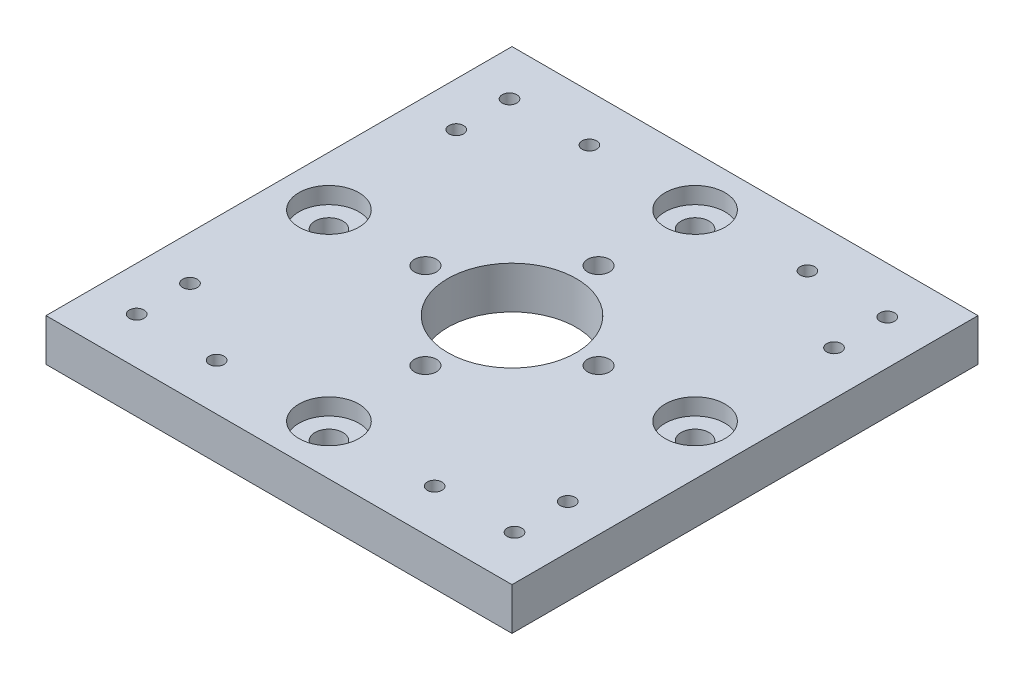
from build123d import *

# Parameters (mm, degrees)
SKETCH1_W           = 70
SKETCH1_H           = 70
SKETCH1_R           = 1.65
BOSS_EXTRUDE1_DEPTH = 6.35
CUT_EXTRUDE1_REACH  = 51.903
SKETCH2_R           = 1.1
CUT_EXTRUDE2_REACH  = 51.903
SKETCH3_R           = 9.65
CUT_EXTRUDE3_REACH  = 51.903
SKETCH4_R           = 2.1
SKETCH5_R           = 4.5
CUT_EXTRUDE4_DEPTH  = 2.5


with BuildPart() as part:
    # Sketch1 → Boss-Extrude1 (new body)
    with BuildSketch(Plane(origin=(0, 0, 0), x_dir=(1, 0, 0), z_dir=(0, 1, 0))):
        Rectangle(SKETCH1_W, SKETCH1_H)
        with Locations(Location((0, 13, 0), (0, 0, 270))):
            Circle(SKETCH1_R, mode=Mode.SUBTRACT)
        with Locations(Location((13, 0, 0), (0, 0, 270))):
            Circle(SKETCH1_R, mode=Mode.SUBTRACT)
        with Locations(Location((0, -13, 0), (0, 0, 270))):
            Circle(SKETCH1_R, mode=Mode.SUBTRACT)
        with Locations(Location((-13, 0, 0), (0, 0, 270))):
            Circle(SKETCH1_R, mode=Mode.SUBTRACT)
    extrude(amount=BOSS_EXTRUDE1_DEPTH)

    # Sketch2 → Cut-Extrude1 (cut, up to next)
    with BuildSketch(Plane(origin=(0, 6.35, 0), x_dir=(1, 0, 0), z_dir=(0, 1, 0)), mode=Mode.PRIVATE) as cut_extrude1_sk1:
        with Locations(Location((16.375, 28, 0), (0, 0, 270))):
            Circle(SKETCH2_R)
    cut_extrude1_tool1 = extrude(cut_extrude1_sk1.sketch, amount=-CUT_EXTRUDE1_REACH, mode=Mode.PRIVATE) & part.part
    # Sketch2 → Cut-Extrude1 (cut, up to next)
    with BuildSketch(Plane(origin=(0, 6.35, 0), x_dir=(1, 0, 0), z_dir=(0, 1, 0)), mode=Mode.PRIVATE) as cut_extrude1_sk2:
        with Locations(Location((28.375, 28, 0), (0, 0, 270))):
            Circle(SKETCH2_R)
    cut_extrude1_tool2 = extrude(cut_extrude1_sk2.sketch, amount=-CUT_EXTRUDE1_REACH, mode=Mode.PRIVATE) & part.part
    # Sketch2 → Cut-Extrude1 (cut, up to next)
    with BuildSketch(Plane(origin=(0, 6.35, 0), x_dir=(1, 0, 0), z_dir=(0, 1, 0)), mode=Mode.PRIVATE) as cut_extrude1_sk3:
        with Locations(Location((28.375, 20, 0), (0, 0, 270))):
            Circle(SKETCH2_R)
    cut_extrude1_tool3 = extrude(cut_extrude1_sk3.sketch, amount=-CUT_EXTRUDE1_REACH, mode=Mode.PRIVATE) & part.part
    # Sketch2 → Cut-Extrude1 (cut, up to next)
    with BuildSketch(Plane(origin=(0, 6.35, 0), x_dir=(1, 0, 0), z_dir=(0, 1, 0)), mode=Mode.PRIVATE) as cut_extrude1_sk4:
        with Locations(Location((-28.375, 20, 0), (0, 0, 270))):
            Circle(SKETCH2_R)
    cut_extrude1_tool4 = extrude(cut_extrude1_sk4.sketch, amount=-CUT_EXTRUDE1_REACH, mode=Mode.PRIVATE) & part.part
    # Sketch2 → Cut-Extrude1 (cut, up to next)
    with BuildSketch(Plane(origin=(0, 6.35, 0), x_dir=(1, 0, 0), z_dir=(0, 1, 0)), mode=Mode.PRIVATE) as cut_extrude1_sk5:
        with Locations(Location((-28.375, 28, 0), (0, 0, 270))):
            Circle(SKETCH2_R)
    cut_extrude1_tool5 = extrude(cut_extrude1_sk5.sketch, amount=-CUT_EXTRUDE1_REACH, mode=Mode.PRIVATE) & part.part
    # Sketch2 → Cut-Extrude1 (cut, up to next)
    with BuildSketch(Plane(origin=(0, 6.35, 0), x_dir=(1, 0, 0), z_dir=(0, 1, 0)), mode=Mode.PRIVATE) as cut_extrude1_sk6:
        with Locations(Location((-16.375, 28, 0), (0, 0, 270))):
            Circle(SKETCH2_R)
    cut_extrude1_tool6 = extrude(cut_extrude1_sk6.sketch, amount=-CUT_EXTRUDE1_REACH, mode=Mode.PRIVATE) & part.part
    # Sketch2 → Cut-Extrude1 (cut, up to next)
    with BuildSketch(Plane(origin=(0, 6.35, 0), x_dir=(1, 0, 0), z_dir=(0, 1, 0)), mode=Mode.PRIVATE) as cut_extrude1_sk7:
        with Locations(Location((28.375, -20, 0), (0, 0, 270))):
            Circle(SKETCH2_R)
    cut_extrude1_tool7 = extrude(cut_extrude1_sk7.sketch, amount=-CUT_EXTRUDE1_REACH, mode=Mode.PRIVATE) & part.part
    # Sketch2 → Cut-Extrude1 (cut, up to next)
    with BuildSketch(Plane(origin=(0, 6.35, 0), x_dir=(1, 0, 0), z_dir=(0, 1, 0)), mode=Mode.PRIVATE) as cut_extrude1_sk8:
        with Locations(Location((28.375, -28, 0), (0, 0, 270))):
            Circle(SKETCH2_R)
    cut_extrude1_tool8 = extrude(cut_extrude1_sk8.sketch, amount=-CUT_EXTRUDE1_REACH, mode=Mode.PRIVATE) & part.part
    # Sketch2 → Cut-Extrude1 (cut, up to next)
    with BuildSketch(Plane(origin=(0, 6.35, 0), x_dir=(1, 0, 0), z_dir=(0, 1, 0)), mode=Mode.PRIVATE) as cut_extrude1_sk9:
        with Locations(Location((16.375, -28, 0), (0, 0, 270))):
            Circle(SKETCH2_R)
    cut_extrude1_tool9 = extrude(cut_extrude1_sk9.sketch, amount=-CUT_EXTRUDE1_REACH, mode=Mode.PRIVATE) & part.part
    # Sketch2 → Cut-Extrude1 (cut, up to next)
    with BuildSketch(Plane(origin=(0, 6.35, 0), x_dir=(1, 0, 0), z_dir=(0, 1, 0)), mode=Mode.PRIVATE) as cut_extrude1_sk10:
        with Locations(Location((-16.375, -28, 0), (0, 0, 270))):
            Circle(SKETCH2_R)
    cut_extrude1_tool10 = extrude(cut_extrude1_sk10.sketch, amount=-CUT_EXTRUDE1_REACH, mode=Mode.PRIVATE) & part.part
    # Sketch2 → Cut-Extrude1 (cut, up to next)
    with BuildSketch(Plane(origin=(0, 6.35, 0), x_dir=(1, 0, 0), z_dir=(0, 1, 0)), mode=Mode.PRIVATE) as cut_extrude1_sk11:
        with Locations(Location((-28.375, -20, 0), (0, 0, 270))):
            Circle(SKETCH2_R)
    cut_extrude1_tool11 = extrude(cut_extrude1_sk11.sketch, amount=-CUT_EXTRUDE1_REACH, mode=Mode.PRIVATE) & part.part
    # Sketch2 → Cut-Extrude1 (cut, up to next)
    with BuildSketch(Plane(origin=(0, 6.35, 0), x_dir=(1, 0, 0), z_dir=(0, 1, 0)), mode=Mode.PRIVATE) as cut_extrude1_sk12:
        with Locations(Location((-28.375, -28, 0), (0, 0, 270))):
            Circle(SKETCH2_R)
    cut_extrude1_tool12 = extrude(cut_extrude1_sk12.sketch, amount=-CUT_EXTRUDE1_REACH, mode=Mode.PRIVATE) & part.part
    add(cut_extrude1_tool1.solids().sort_by_distance((16.375, 6.35, -28))[0], mode=Mode.SUBTRACT)
    add(cut_extrude1_tool2.solids().sort_by_distance((28.375, 6.35, -28))[0], mode=Mode.SUBTRACT)
    add(cut_extrude1_tool3.solids().sort_by_distance((28.375, 6.35, -20))[0], mode=Mode.SUBTRACT)
    add(cut_extrude1_tool4.solids().sort_by_distance((-28.375, 6.35, -20))[0], mode=Mode.SUBTRACT)
    add(cut_extrude1_tool5.solids().sort_by_distance((-28.375, 6.35, -28))[0], mode=Mode.SUBTRACT)
    add(cut_extrude1_tool6.solids().sort_by_distance((-16.375, 6.35, -28))[0], mode=Mode.SUBTRACT)
    add(cut_extrude1_tool7.solids().sort_by_distance((28.375, 6.35, 20))[0], mode=Mode.SUBTRACT)
    add(cut_extrude1_tool8.solids().sort_by_distance((28.375, 6.35, 28))[0], mode=Mode.SUBTRACT)
    add(cut_extrude1_tool9.solids().sort_by_distance((16.375, 6.35, 28))[0], mode=Mode.SUBTRACT)
    add(cut_extrude1_tool10.solids().sort_by_distance((-16.375, 6.35, 28))[0], mode=Mode.SUBTRACT)
    add(cut_extrude1_tool11.solids().sort_by_distance((-28.375, 6.35, 20))[0], mode=Mode.SUBTRACT)
    add(cut_extrude1_tool12.solids().sort_by_distance((-28.375, 6.35, 28))[0], mode=Mode.SUBTRACT)

    # Sketch3 → Cut-Extrude2 (cut, up to next)
    with BuildSketch(Plane(origin=(0, 6.35, 0), x_dir=(1, 0, 0), z_dir=(0, 1, 0)), mode=Mode.PRIVATE) as cut_extrude2_sk1:
        with Locations(Location((0, 0, 0), (0, 0, 270))):
            Circle(SKETCH3_R)
    cut_extrude2_tool1 = extrude(cut_extrude2_sk1.sketch, amount=-CUT_EXTRUDE2_REACH, mode=Mode.PRIVATE) & part.part
    add(cut_extrude2_tool1.solids().sort_by_distance((0, 6.35, 0))[0], mode=Mode.SUBTRACT)

    # Sketch4 → Cut-Extrude3 (cut, up to next)
    with BuildSketch(Plane(origin=(0, 6.35, 0), x_dir=(1, 0, 0), z_dir=(0, 1, 0)), mode=Mode.PRIVATE) as cut_extrude3_sk1:
        with Locations(Location((0, 27.5, 0), (0, 0, 270))):
            Circle(SKETCH4_R)
    cut_extrude3_tool1 = extrude(cut_extrude3_sk1.sketch, amount=-CUT_EXTRUDE3_REACH, mode=Mode.PRIVATE) & part.part
    # Sketch4 → Cut-Extrude3 (cut, up to next)
    with BuildSketch(Plane(origin=(0, 6.35, 0), x_dir=(1, 0, 0), z_dir=(0, 1, 0)), mode=Mode.PRIVATE) as cut_extrude3_sk2:
        with Locations(Location((27.5, 0, 0), (0, 0, 270))):
            Circle(SKETCH4_R)
    cut_extrude3_tool2 = extrude(cut_extrude3_sk2.sketch, amount=-CUT_EXTRUDE3_REACH, mode=Mode.PRIVATE) & part.part
    # Sketch4 → Cut-Extrude3 (cut, up to next)
    with BuildSketch(Plane(origin=(0, 6.35, 0), x_dir=(1, 0, 0), z_dir=(0, 1, 0)), mode=Mode.PRIVATE) as cut_extrude3_sk3:
        with Locations(Location((0, -27.5, 0), (0, 0, 270))):
            Circle(SKETCH4_R)
    cut_extrude3_tool3 = extrude(cut_extrude3_sk3.sketch, amount=-CUT_EXTRUDE3_REACH, mode=Mode.PRIVATE) & part.part
    # Sketch4 → Cut-Extrude3 (cut, up to next)
    with BuildSketch(Plane(origin=(0, 6.35, 0), x_dir=(1, 0, 0), z_dir=(0, 1, 0)), mode=Mode.PRIVATE) as cut_extrude3_sk4:
        with Locations(Location((-27.5, 0, 0), (0, 0, 270))):
            Circle(SKETCH4_R)
    cut_extrude3_tool4 = extrude(cut_extrude3_sk4.sketch, amount=-CUT_EXTRUDE3_REACH, mode=Mode.PRIVATE) & part.part
    add(cut_extrude3_tool1.solids().sort_by_distance((0, 6.35, -27.5))[0], mode=Mode.SUBTRACT)
    add(cut_extrude3_tool2.solids().sort_by_distance((27.5, 6.35, 0))[0], mode=Mode.SUBTRACT)
    add(cut_extrude3_tool3.solids().sort_by_distance((0, 6.35, 27.5))[0], mode=Mode.SUBTRACT)
    add(cut_extrude3_tool4.solids().sort_by_distance((-27.5, 6.35, 0))[0], mode=Mode.SUBTRACT)

    # Sketch5 → Cut-Extrude4 (cut)
    with BuildSketch(Plane(origin=(0, 6.35, 0), x_dir=(1, 0, 0), z_dir=(0, 1, 0))):
        with Locations(Location((0, 27.5, 0), (0, 0, 270))):
            Circle(SKETCH5_R)
        with Locations(Location((27.5, 0, 0), (0, 0, 270))):
            Circle(SKETCH5_R)
        with Locations(Location((0, -27.5, 0), (0, 0, 270))):
            Circle(SKETCH5_R)
        with Locations(Location((-27.5, 0, 0), (0, 0, 270))):
            Circle(SKETCH5_R)
    extrude(amount=-CUT_EXTRUDE4_DEPTH, mode=Mode.SUBTRACT)


solid = part.part
